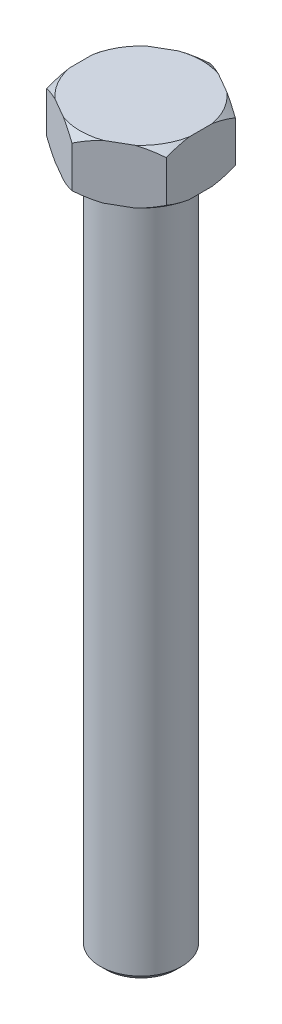
from build123d import *

# Parameters (mm, degrees)
BOSS_EXTRUDE1_DEPTH = 10
SKETCH2_R           = 7.5
BOSS_EXTRUDE2_DEPTH = 126
CHAMFER1_SIZE       = 1


with BuildPart() as part:
    # Sketch1 → Boss-Extrude1 (new body)
    with BuildSketch(Plane(origin=(0, 0, 0), x_dir=(1, 0, 0), z_dir=(0, 1, 0))):
        Polygon((0, 12.701705922), (-11, 6.350852961), (-11, -6.350852961), (0, -12.701705922), (11, -6.350852961), (11, 6.350852961), align=None)
    extrude(amount=BOSS_EXTRUDE1_DEPTH)

    # Sketch2 → Boss-Extrude2 (add)
    with BuildSketch(Plane.XZ):
        with Locations(Location((0, 0, 0), (0, 0, 270))):
            Circle(SKETCH2_R)
    extrude(amount=BOSS_EXTRUDE2_DEPTH)

    # Chamfer1
    chamfer1_edges = [part.edges().sort_by_distance(p)[0] for p in [
        (0, -126, 7.5),
    ]]
    chamfer(chamfer1_edges, length=CHAMFER1_SIZE)

    # Sketch4 → Cut-Revolve3 (revolve, cut)
    with BuildSketch(Plane(origin=(0, 0, 0), x_dir=(0, 0, -1), z_dir=(1, 0, 0))):
        Polygon((-12.701705922, 10), (-11.201705922, 10), (-12.701705922, 8.8), align=None)
        Polygon((-12.701705922, 0), (-11.201705922, 0), (-12.701705922, 1.2), align=None)
    revolve(axis=Axis((0, 0, 0), (0, 1, 0)), mode=Mode.SUBTRACT)


solid = part.part
